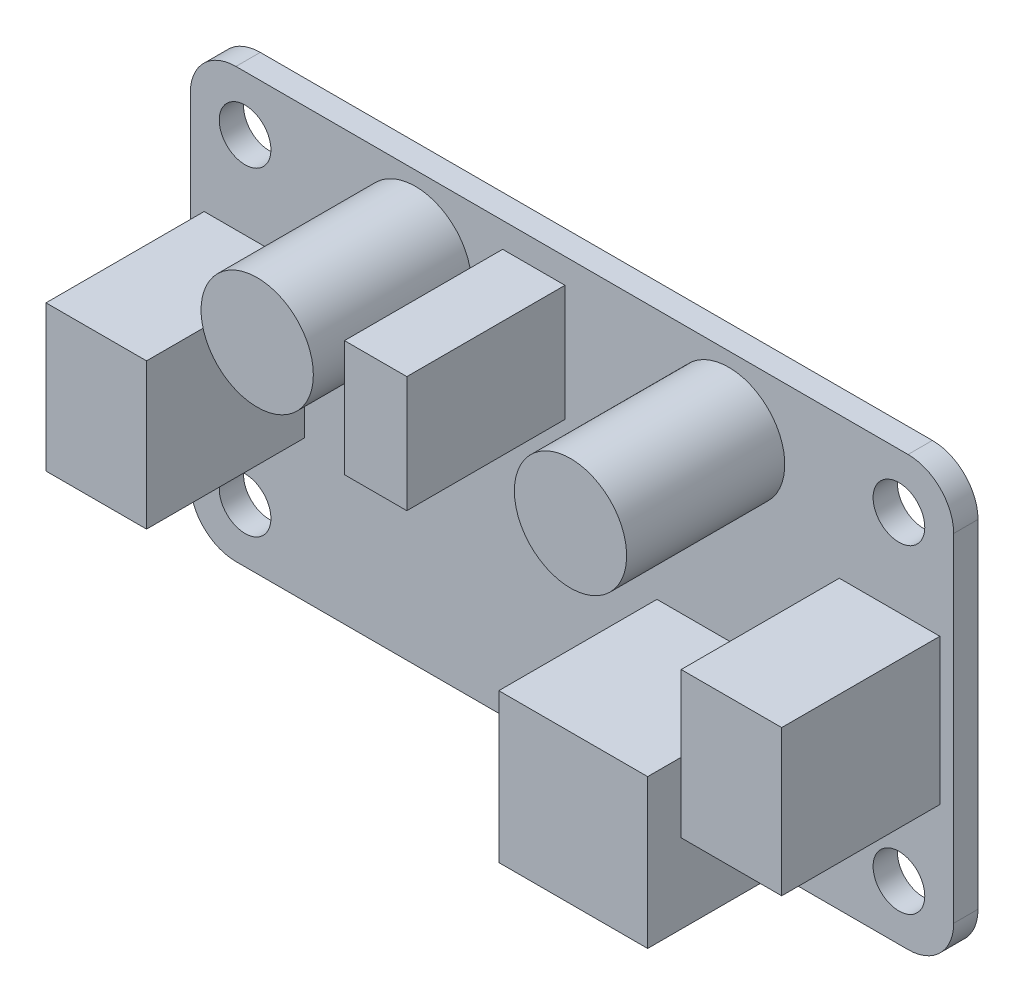
from build123d import *

# Parameters (mm, degrees)
ESQUISSE1_W        = 50.2
ESQUISSE1_H        = 28.2
BOSS_EXTRU_1_DEPTH = 1.6
D_GAGEMENT_M31_D   = 3.4
CONG_1_R           = 3
ESQUISSE5_R        = 3.691889044
ESQUISSE5_W        = 6.611446916
ESQUISSE5_H        = 9.58403545
ESQUISSE5_W_2      = 4.100122118
ESQUISSE5_H_2      = 7.636477445
ESQUISSE5_W_3      = 9.789041557
ESQUISSE5_H_3      = 9.789041557
BOSS_EXTRU_2_DEPTH = 10.4


with BuildPart() as part:
    # Esquisse1 → Boss.-Extru.1 (new body)
    with BuildSketch(Plane.XY):
        Rectangle(ESQUISSE1_W, ESQUISSE1_H)
    extrude(amount=BOSS_EXTRU_1_DEPTH)

    # Dégagement M31 (through all)
    with Locations(Plane.XY.offset(1.6)):
        with Locations((-21.5, 10.5), (21.5, 10.5), (21.5, -10.5), (-21.5, -10.5)):
            Hole(D_GAGEMENT_M31_D / 2)

    # Congé1
    cong_1_edges = [part.edges().sort_by_distance(p)[0] for p in [
        (-25.1, 14.1, 0.8),
        (25.1, 14.1, 0.8),
        (25.1, -14.1, 0.8),
        (-25.1, -14.1, 0.8),
    ]]
    fillet(cong_1_edges, radius=CONG_1_R)

    # Esquisse5 → Boss.-Extru.2 (add)
    with BuildSketch(Plane.XY.offset(1.6)):
        with Locations((-10.301556822, 9.481532398)):
            Circle(ESQUISSE5_R)
        with Locations(Location((10.301556822, 9.481532398, 0), (0, 0, 180))):
            Circle(ESQUISSE5_R)
        with Locations((-20.884997039, 0)):
            Rectangle(ESQUISSE5_W, ESQUISSE5_H)
        with Locations((20.884997039, 0)):
            Rectangle(ESQUISSE5_W, ESQUISSE5_H)
        with Locations((-2.511324797, 8.635882212)):
            Rectangle(ESQUISSE5_W_2, ESQUISSE5_H_2)
        with Locations((10.480937165, -7.303342522)):
            Rectangle(ESQUISSE5_W_3, ESQUISSE5_H_3)
    extrude(amount=BOSS_EXTRU_2_DEPTH)


solid = part.part
